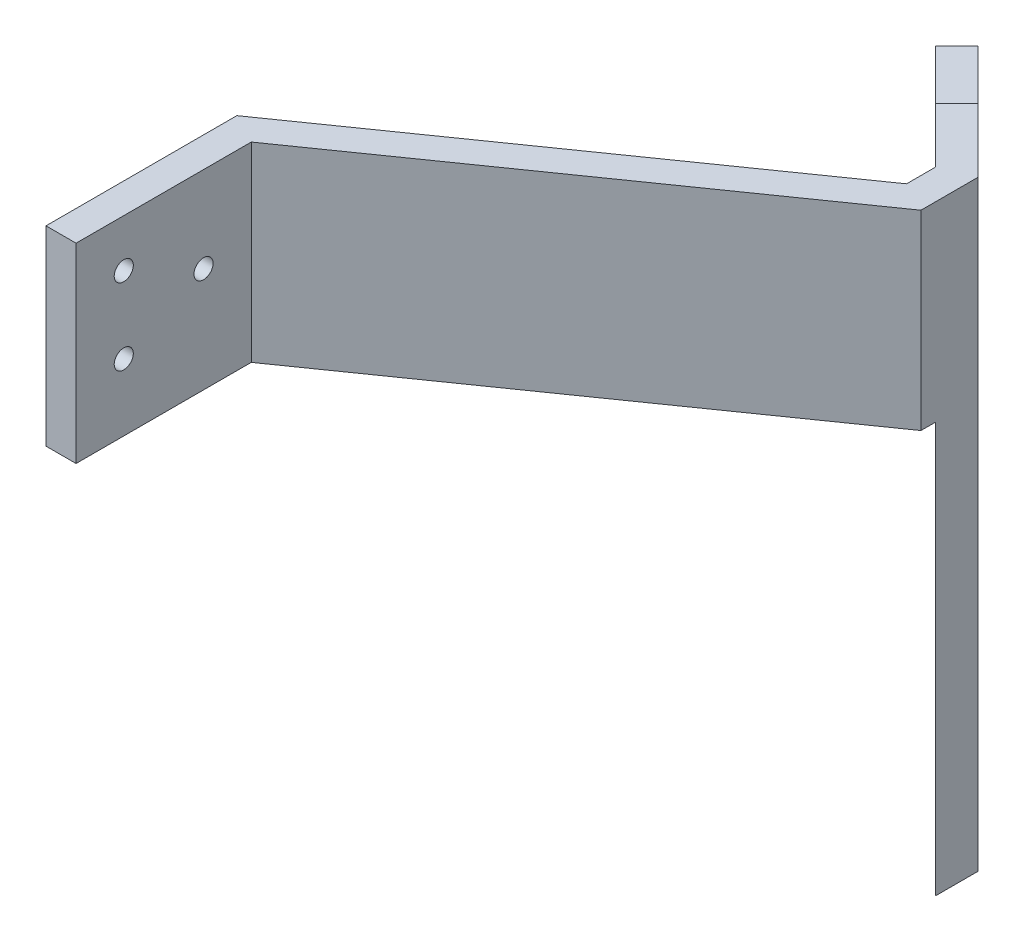
from build123d import *

# Parameters (mm, degrees)
PROFILEBOSS_EXTRUDE1_DEPTH      = 31.75
RIGHTPROFILEBOSS_EXTRUDE2_DEPTH = 68.25
SKETCH6_W                       = 5
SKETCH6_H                       = 62.32526864
TOPPROFILEBOSS_EXTRUDE5_DEPTH   = 65
SKETCH7_R                       = 2.25
HDMI_HOLESCUT_EXTRUDE1_DEPTH    = 130.147862652
SKETCH8_R                       = 1.5875
MOUNTHOLESCUT_EXTRUDE2_DEPTH    = 170.880700314
SKETCH9_R                       = 2.6
HDMIBORECUT_EXTRUDE3_DEPTH      = 1


with BuildPart() as part:
    # Sketch1 → ProfileBoss-Extrude1 (new body)
    with BuildSketch(Plane(origin=(0, 0, 0), x_dir=(1, 0, 0), z_dir=(0, 1, 0))):
        Polygon((0, 0), (0, 31.75), (65.532163543, 77.636114908), (65.532163543, 82.452293716), (56.390027919, 91.594429339), (59.925561825, 95.129963245), (70.532163543, 84.523361528), (70.532163543, 75.033279655), (5, 29.147164747), (5, 0), align=None)
    extrude(amount=PROFILEBOSS_EXTRUDE1_DEPTH)

    # Sketch2 → RightProfileBoss-Extrude2 (add)
    with BuildSketch(Plane.XZ):
        Polygon((59.925561825, -95.129963245), (70.532163543, -84.523361528), (70.532163543, -77.452293716), (65.532163543, -82.452293716), (56.390027919, -91.594429339), align=None)
    extrude(amount=RIGHTPROFILEBOSS_EXTRUDE2_DEPTH)

    # Sketch6 → TopProfileBoss-Extrude5 (add)
    with BuildSketch(Plane(origin=(-17.60220071, 0, -17.60220071), x_dir=(-0.7071067811865449, 0, 0.7071067811865502), z_dir=(-0.7071067811865502, 0, -0.7071067811865449))):
        with Locations((-107.140813238, -37.08736568)):
            Rectangle(SKETCH6_W, SKETCH6_H)
    extrude(amount=TOPPROFILEBOSS_EXTRUDE5_DEPTH)

    # Sketch7 → HDMI HolesCut-Extrude1 (cut, through all)
    with BuildSketch(Plane(origin=(77.527762535, 0, -77.527762535), x_dir=(-0.7071067811865493, 0, -0.7071067811865457), z_dir=(0.7071067811865457, 0, -0.7071067811865493))):
        with Locations((82.893270972, -11.25)):
            Circle(SKETCH7_R)
        with Locations((57.893270972, -11.25)):
            Circle(SKETCH7_R)
        with Locations((82.893270972, -61.25)):
            Circle(SKETCH7_R)
        with Locations((57.893270972, -61.25)):
            Circle(SKETCH7_R)
    extrude(amount=-HDMI_HOLESCUT_EXTRUDE1_DEPTH, mode=Mode.SUBTRACT)

    # Sketch8 → MountHolesCut-Extrude2 (cut, through all)
    with BuildSketch(Plane(origin=(5, 0, 0), x_dir=(0, 0, -1), z_dir=(1, 0, 0))):
        with Locations((7.9375, 23.8125)):
            Circle(SKETCH8_R)
        with Locations((21.209664747, 17.4625)):
            Circle(SKETCH8_R)
        with Locations((7.9375, 11.1125)):
            Circle(SKETCH8_R)
    extrude(amount=-MOUNTHOLESCUT_EXTRUDE2_DEPTH, mode=Mode.SUBTRACT)

    # Sketch9 → HDMIBoreCut-Extrude3 (cut)
    with BuildSketch(Plane(origin=(77.527762535, 0, -77.527762535), x_dir=(-0.7071067811865493, 0, -0.7071067811865457), z_dir=(0.7071067811865457, 0, -0.7071067811865493))):
        with Locations((57.893270972, -11.25)):
            Circle(SKETCH9_R)
        with Locations((82.893270972, -11.25)):
            Circle(SKETCH9_R)
        with Locations((82.893270972, -61.25)):
            Circle(SKETCH9_R)
        with Locations((57.893270972, -61.25)):
            Circle(SKETCH9_R)
    extrude(amount=-HDMIBORECUT_EXTRUDE3_DEPTH, mode=Mode.SUBTRACT)


solid = part.part
